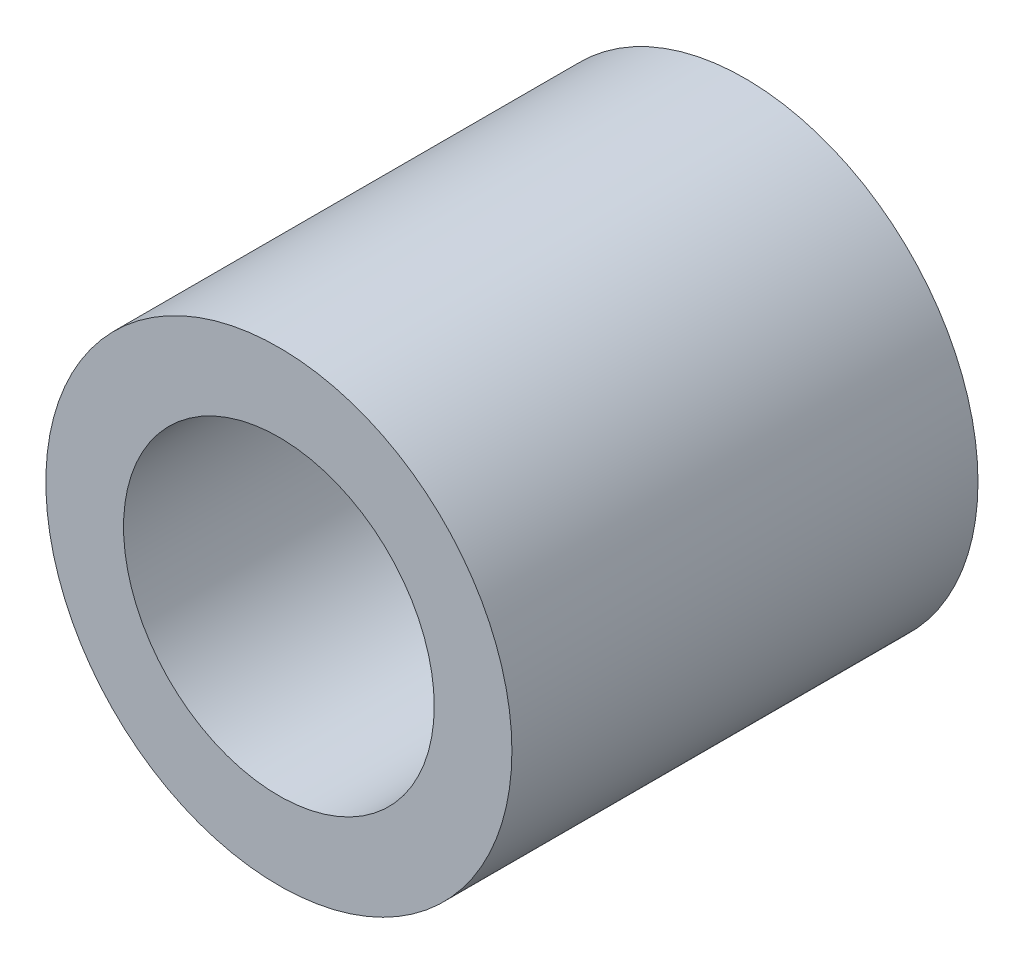
from build123d import *

# Parameters (mm, degrees)
SKETCH1_R           = 4.5
SKETCH1_R_2         = 3
BOSS_EXTRUDE1_DEPTH = 9


with BuildPart() as part:
    # Sketch1 → Boss-Extrude1 (new body)
    with BuildSketch(Plane.XY):
        Circle(SKETCH1_R)
        Circle(SKETCH1_R_2, mode=Mode.SUBTRACT)
    extrude(amount=BOSS_EXTRUDE1_DEPTH)


solid = part.part
